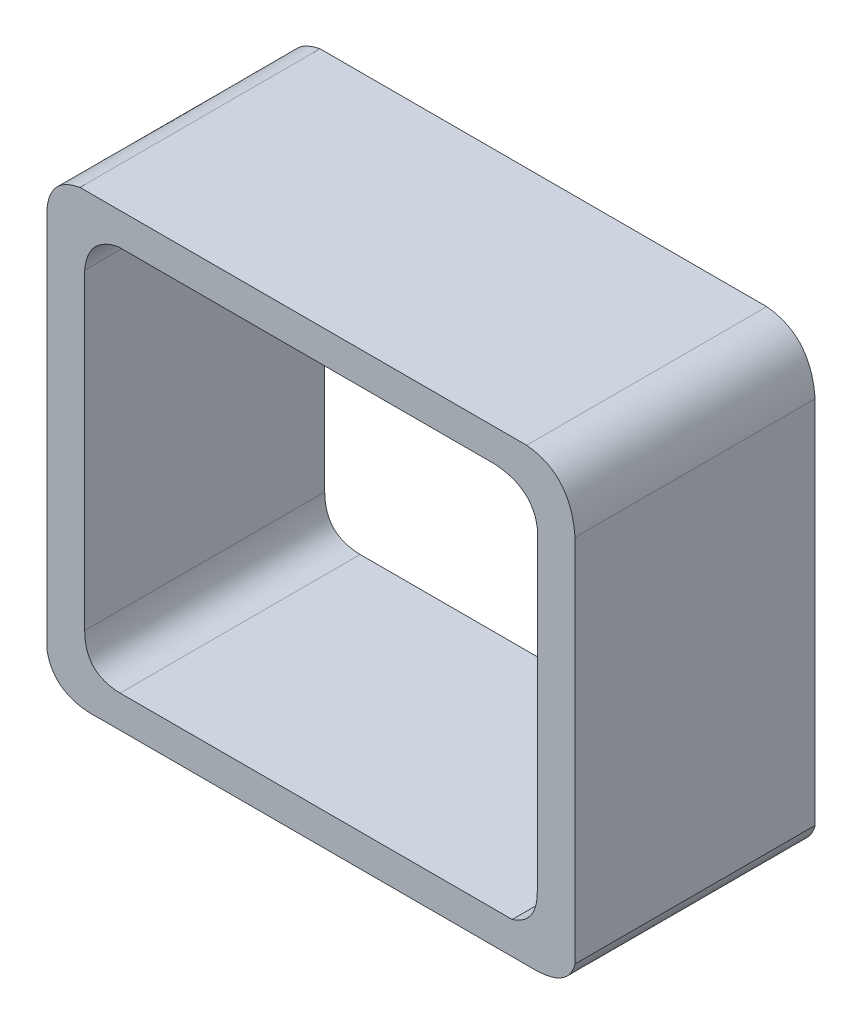
from build123d import *

# Parameters (mm, degrees)
BOSS_EXTRUDE4_DEPTH = 16


with BuildPart() as part:
    # Sketch3 → Boss-Extrude4 (new body)
    with BuildSketch(Plane.XY):
        with BuildLine():
            Line((-15.394959284, 15), (14.37206817, 15))
            add(Edge.make_bspline(
                [(14.37206817, 15), (16.344314338, 14.806153618), (17.421724303, 13.573948287), (17.604298066, 11.303384007)],
                knots=[0.157316623, 0.157316623, 0.157316623, 0.157316623, 1, 1, 1, 1], degree=3))
            Line((17.604298066, 11.303384007), (17.604298066, -13.324081778))
            add(Edge.make_bspline(
                [(17.604298066, -13.324081778), (17.337095636, -14.377577199), (16.496568016, -14.936216606), (15.082715206, -15)],
                knots=[0.317898453, 0.317898453, 0.317898453, 0.317898453, 1, 1, 1, 1], degree=3))
            Line((15.082715206, -15), (-13.989571853, -15))
            add(Edge.make_bspline(
                [(-17.604298066, -12.776063834), (-17.290256291, -14.390282227), (-16.085347553, -15.131594282), (-13.989571853, -15)],
                knots=[0.26063532, 0.26063532, 0.26063532, 0.26063532, 1, 1, 1, 1], degree=3))
            Line((-17.604298066, -12.776063834), (-17.604298066, 12.407487922))
            add(Edge.make_bspline(
                [(-17.604298066, 12.407487922), (-17.542065798, 14.610208227), (-15.394959284, 15)],
                knots=[0, 0, 0, 1, 1, 1], degree=2))
        make_face()
        with BuildLine():
            Line((-12.868921273, 12.851448393), (12.290353953, 12.851448393))
            add(Edge.make_bspline(
                [(12.290353953, 12.851448393), (13.937663202, 12.716565565), (14.868450289, 11.970465373), (15.082715212, 10.613147816)],
                knots=[0, 0, 0, 0, 0.769802432, 0.769802432, 0.769802432, 0.769802432], degree=3))
            Line((15.082715212, 10.613147816), (15.082715212, -10.422758289))
            add(Edge.make_bspline(
                [(15.082715212, -10.422758289), (15.08124759, -12.316637726), (13.415493999, -12.851448393)],
                knots=[0, 0, 0, 1, 1, 1], degree=2))
            Line((13.415493999, -12.851448393), (-12.720345322, -12.851448393))
            add(Edge.make_bspline(
                [(-15.082715206, -10.422758289), (-15.079137607, -12.799186037), (-12.720345322, -12.851448393)],
                knots=[0, 0, 0, 1, 1, 1], degree=2))
            Line((-15.082715206, -10.422758289), (-15.082715206, 10.375039522))
            add(Edge.make_bspline(
                [(-15.082715206, 10.375039522), (-14.901913362, 12.422179601), (-12.868921273, 12.851448393)],
                knots=[0, 0, 0, 1, 1, 1], degree=2))
        make_face(mode=Mode.SUBTRACT)
    extrude(amount=BOSS_EXTRUDE4_DEPTH)


solid = part.part
